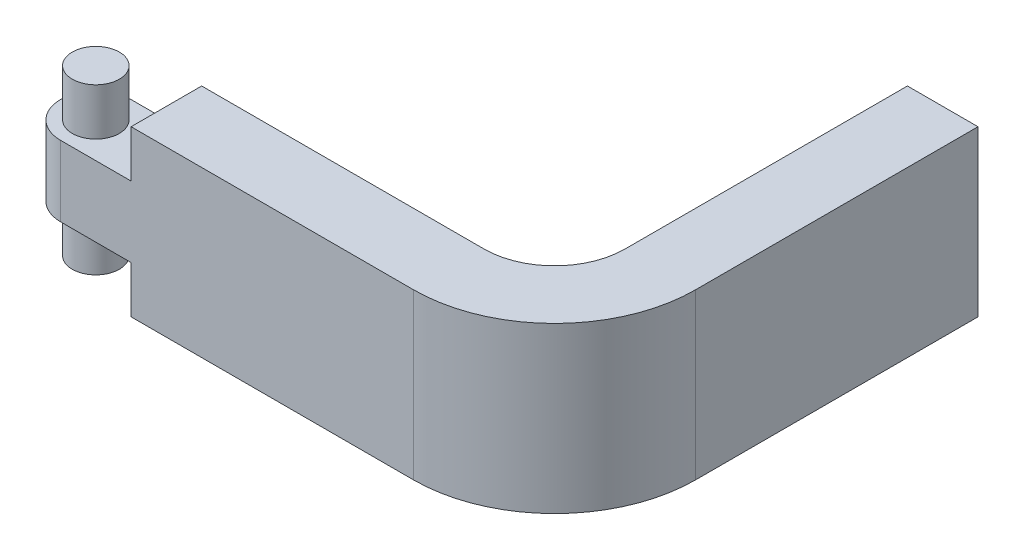
from build123d import *

# Parameters (mm, degrees)
EXTRUDE_1_DEPTH      = 7.5
EXTRUDE_1_DEPTH_BACK = 7.5
SKETCH_1_R           = 5
SKETCH_2_R           = 5
EXTRUDE_2_DEPTH      = 17.5
EXTRUDE_3_DEPTH      = 10


with BuildPart() as part:
    # 草图1 → 凸台-拉伸1 (new, two sides: drawn at the far end of the back side and taken through both)
    with BuildSketch(Plane(origin=(0, 0, 0), x_dir=(1, 0, 0), z_dir=(0, 1, 0)).offset(-EXTRUDE_1_DEPTH_BACK)):
        with BuildLine():
            Line((0, 0), (75, 0))
            ThreePointArc((75, 0), (96.213203436, 8.786796564), (105, 30))
            Line((105, 30), (105, 90))
            Line((105, 90), (90.00000671, 90))
            Line((90.00000671, 90), (90.00000671, 30))
            ThreePointArc((90.00000671, 30), (85.606608428, 19.393398282), (75.00000671, 15))
            Line((75.00000671, 15), (0, 15))
            ThreePointArc((0, 15), (-7.5, 7.5), (0, 0))
        make_face()
        with Locations((0, 7.5)):
            Circle(SKETCH_1_R, mode=Mode.SUBTRACT)
    extrude(amount=EXTRUDE_1_DEPTH + EXTRUDE_1_DEPTH_BACK)

    # 草图2 → 凸台-拉伸2 (add, symmetric)
    with BuildSketch(Plane(origin=(0, 0, 0), x_dir=(1, 0, 0), z_dir=(0, 1, 0))):
        with Locations((0, 7.5)):
            Circle(SKETCH_2_R)
    extrude(amount=EXTRUDE_2_DEPTH, both=True)

    # 草图3 → 凸台-拉伸3 (add)
    with BuildSketch(Plane(origin=(0, 7.5, 0), x_dir=(1, 0, 0), z_dir=(0, 1, 0))):
        with BuildLine():
            Line((90.00000671, 90), (90.00000671, 30))
            ThreePointArc((90.00000671, 30), (85.606608428, 19.393398282), (75.00000671, 15))
            Line((75.00000671, 15), (15.00000671, 15))
            Line((15.00000671, 15), (15.00000671, 0))
            Line((15.00000671, 0), (75, 0))
            ThreePointArc((75, 0), (96.213203436, 8.786796564), (105, 30))
            Line((105, 30), (105, 90))
            Line((105, 90), (90.00000671, 90))
        make_face()
    extrude_3 = extrude(amount=EXTRUDE_3_DEPTH)

    # 镜向1: 凸台-拉伸3 across plane
    add(extrude_3.mirror(Plane.ZX))


solid = part.part
